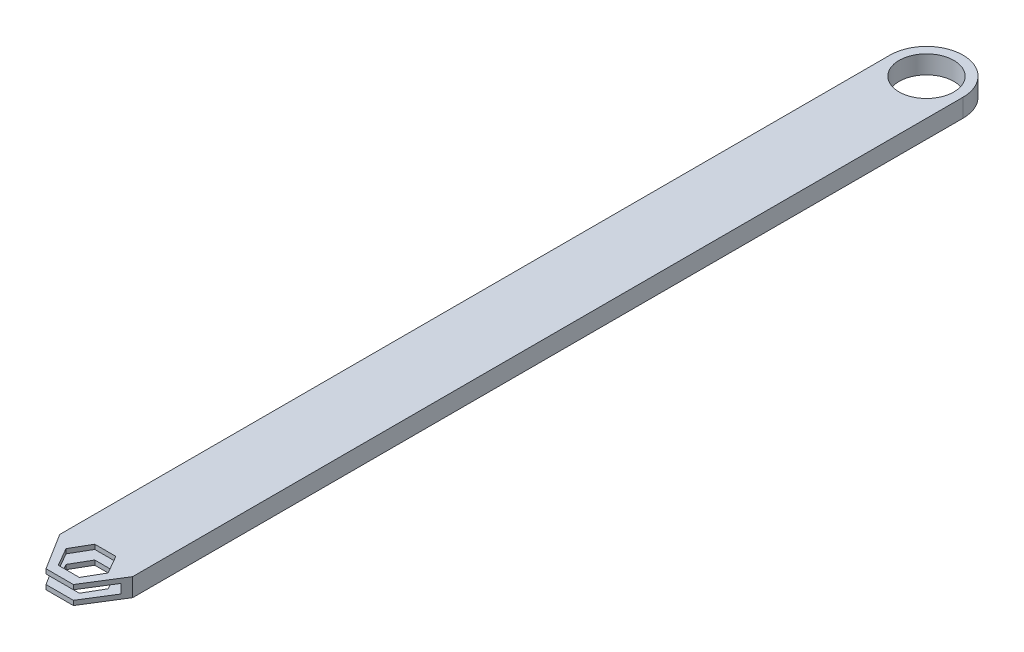
from build123d import *

# Parameters (mm, degrees)
SKETCH1_W           = 25.4
SKETCH1_H           = 6.35
BOSS_EXTRUDE1_DEPTH = 304.8
SKETCH2_W           = 22.225
SKETCH2_H           = 3.175
CUT_EXTRUDE1_DEPTH  = 306.922412549
CUT_EXTRUDE2_DEPTH  = 306.922412549
CUT_EXTRUDE3_DEPTH  = 306.922412549
SKETCH5_R           = 12.7
BOSS_EXTRUDE2_DEPTH = 6.35
SKETCH6_R           = 9.525
CUT_EXTRUDE4_DEPTH  = 303.759183387


with BuildPart() as part:
    # Sketch1 → Boss-Extrude1 (new body)
    with BuildSketch(Plane.XY):
        with Locations((12.7, 3.175)):
            Rectangle(SKETCH1_W, SKETCH1_H)
    extrude(amount=BOSS_EXTRUDE1_DEPTH)

    # Sketch2 → Cut-Extrude1 (cut, through all)
    with BuildSketch(Plane.XY.offset(304.8)):
        with Locations((12.7, 3.175)):
            Rectangle(SKETCH2_W, SKETCH2_H)
    extrude(amount=-CUT_EXTRUDE1_DEPTH, mode=Mode.SUBTRACT)

    # Sketch3 → Cut-Extrude2 (cut, through all)
    with BuildSketch(Plane.XZ):
        Polygon((20.032348419, 292.1), (16.366174209, 298.45), (9.033825791, 298.45), (5.367651581, 292.1), (9.033825791, 285.75), (16.366174209, 285.75), align=None)
    extrude(amount=-CUT_EXTRUDE2_DEPTH, mode=Mode.SUBTRACT)

    # Sketch4 → Cut-Extrude3 (cut, through all)
    with BuildSketch(Plane(origin=(0, 6.35, 0), x_dir=(1, 0, 0), z_dir=(0, 1, 0))):
        Polygon((0, -288.925), (7.9375, -301.625), (17.4625, -301.625), (25.4, -288.925), (25.4, -304.8), (0, -304.8), align=None)
    extrude(amount=-CUT_EXTRUDE3_DEPTH, mode=Mode.SUBTRACT)

    # Sketch5 → Boss-Extrude2 (add)
    with BuildSketch(Plane(origin=(0, 6.35, 0), x_dir=(1, 0, 0), z_dir=(0, 1, 0))):
        with Locations((12.7, 0)):
            Circle(SKETCH5_R)
    extrude(amount=-BOSS_EXTRUDE2_DEPTH)

    # Sketch6 → Cut-Extrude4 (cut, through all)
    with BuildSketch(Plane(origin=(0, 6.35, 0), x_dir=(1, 0, 0), z_dir=(0, 1, 0))):
        with Locations(Location((12.7, 0, 0), (0, 0, 270))):
            Circle(SKETCH6_R)
    extrude(amount=-CUT_EXTRUDE4_DEPTH, mode=Mode.SUBTRACT)


solid = part.part
